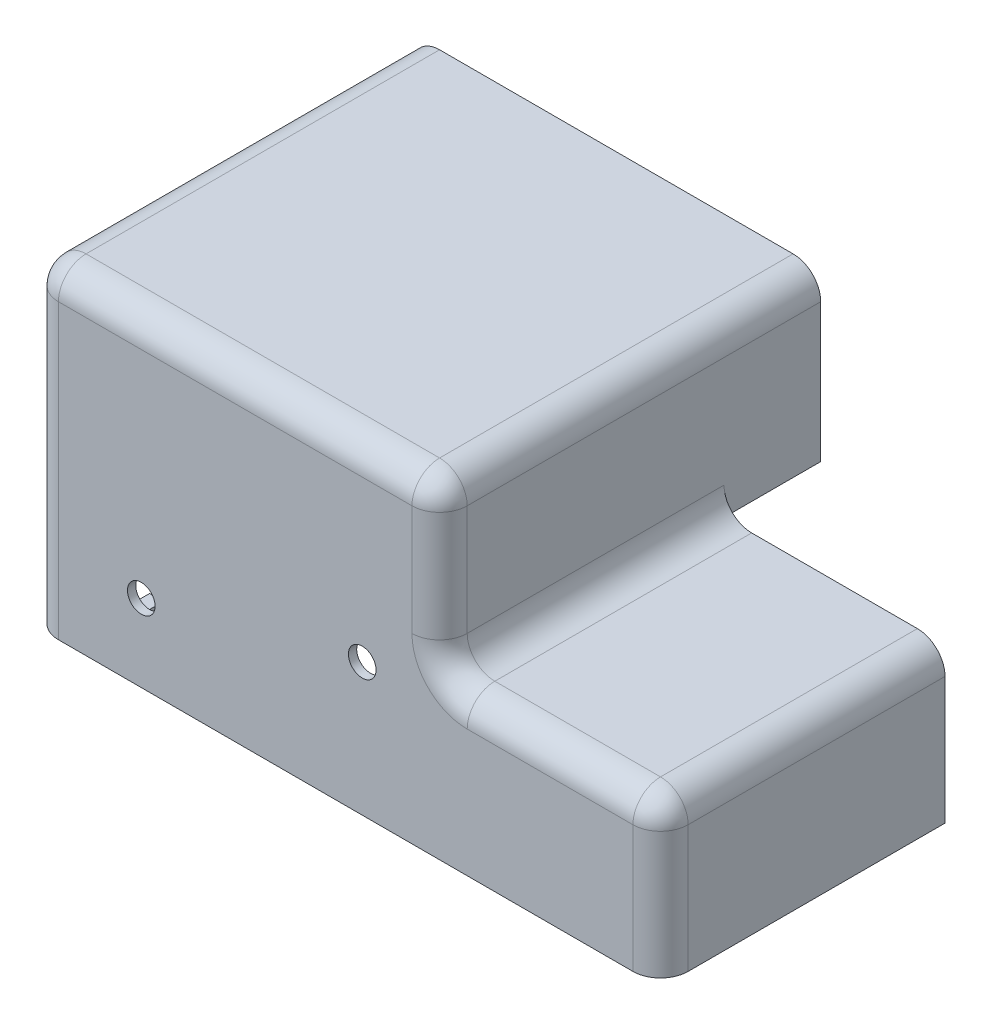
from build123d import *

# Parameters (mm, degrees)
BOSS_EXTRUDE1_DEPTH = 100
BOSS_EXTRUDE2_DEPTH = 3
SKETCH3_R           = 5
CUT_EXTRUDE1_DEPTH  = 3
SKETCH4_W           = 5
SKETCH4_H           = 5
SKETCH4_W_2         = 60
BOSS_EXTRUDE3_DEPTH = 15
BOSS_EXTRUDE4_DEPTH = 35
FILLET2_R           = 10


with BuildPart() as part:
    # Sketch1 → Boss-Extrude1 (new body)
    with BuildSketch(Plane.XY):
        Polygon((-212, 8), (-220, 8), (-220, 116), (-72, 116), (-72, 56), (8, 56), (8, 0), (0, 0), (0, 3), (5, 3), (5, 53), (-75, 53), (-75, 113), (-217, 113), (-217, 11), (-212, 11), align=None)
    extrude(amount=BOSS_EXTRUDE1_DEPTH)

    # Sketch2 → Boss-Extrude2 (add)
    with BuildSketch(Plane.XY.offset(100)):
        Polygon((0, 0), (8, 0), (8, 56), (-72, 56), (-72, 116), (-220, 116), (-220, 8), (-220, 0), align=None)
    extrude(amount=BOSS_EXTRUDE2_DEPTH)

    # Sketch3 → Cut-Extrude1 (cut)
    with BuildSketch(Plane.XY.offset(103)):
        with Locations((-180, 28)):
            Circle(SKETCH3_R)
        with Locations((-100, 48)):
            Circle(SKETCH3_R)
    extrude(amount=-CUT_EXTRUDE1_DEPTH, mode=Mode.SUBTRACT)

    # Sketch4 → Boss-Extrude3 (add)
    with BuildSketch(Plane(origin=(0, 0, 100), x_dir=(-1, 0, 0), z_dir=(0, 0, -1))):
        with Locations((192.5, 10.5)):
            Rectangle(SKETCH4_W, SKETCH4_H)
        with Locations((54.8, 10.5)):
            Rectangle(SKETCH4_W_2, SKETCH4_H)
    extrude(amount=BOSS_EXTRUDE3_DEPTH)

    # Sketch5 → Boss-Extrude4 (add)
    with BuildSketch(Plane(origin=(0, 0, 0), x_dir=(-1, 0, 0), z_dir=(0, 0, -1))):
        Polygon((72, 116), (220, 116), (220, 81), (217, 81), (217, 113), (75, 113), (75, 53), (72, 53), (72, 56), align=None)
    extrude(amount=BOSS_EXTRUDE4_DEPTH)

    # Fillet2
    fillet2_edges = [part.edges().sort_by_distance(p)[0] for p in [
        (-32, 56, 103),
        (-220, 58, 103),
        (8, 28, 103),
        (-72, 86, 103),
        (-146, 116, 103),
        (-220, 116, 34),
        (-217, 113, 32.5),
        (5, 53, 50),
        (8, 56, 51.5),
        (-75, 53, 32.5),
        (-75, 113, 32.5),
        (-72, 56, 51.5),
        (-72, 116, 34),
    ]]
    fillet(fillet2_edges, radius=FILLET2_R)


solid = part.part
